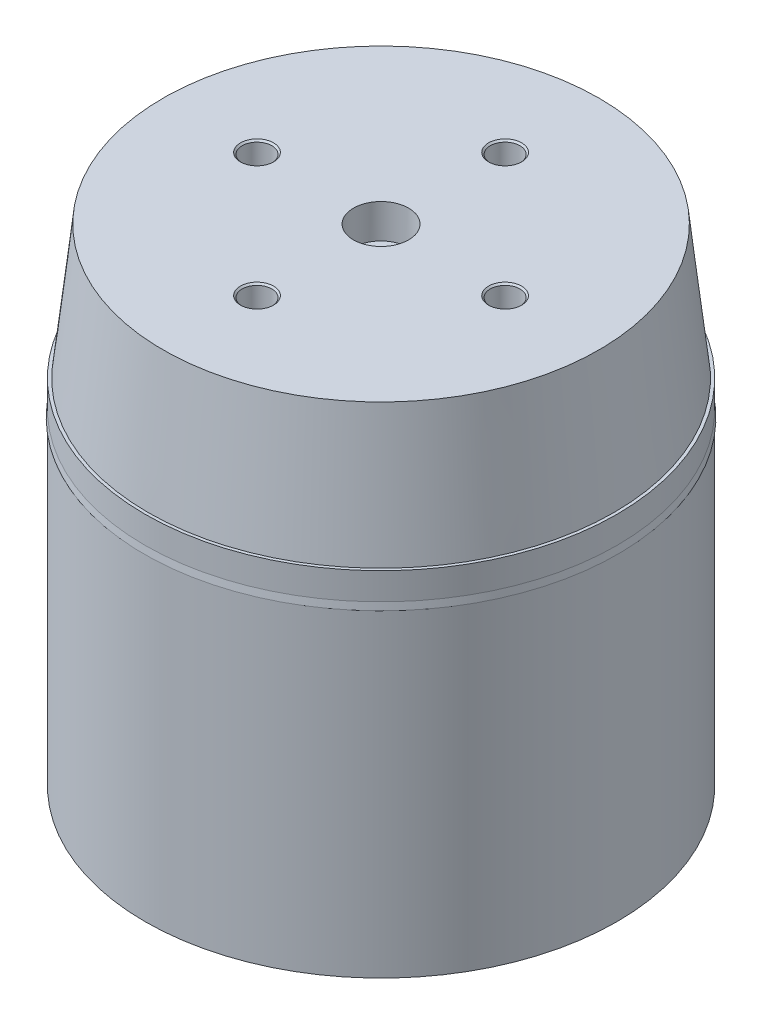
from build123d import *

# Parameters (mm, degrees)
SKETCH_1_R                = 21.4
SKETCH_1_R_2              = 18
EXTRUDE_1_DEPTH           = 32
SKETCH_13_R               = 2.5
CUT_EXTRUDE_1_DEPTH       = 54.544415829
HOLE_WIZARD_1_D           = 2.7
HOLE_WIZARD_1_CSINK_D     = 3
HOLE_WIZARD_1_CSINK_ANGLE = 90


with BuildPart() as part:
    # 草图1 → 凸台-拉伸1 (new body)
    with BuildSketch(Plane(origin=(0, 0, 0), x_dir=(1, 0, 0), z_dir=(0, 1, 0))):
        with Locations(Location((0, 0, 0), (0, 0, 270))):
            Circle(SKETCH_1_R)
        with Locations(Location((0, 0, 0), (0, 0, 270))):
            Circle(SKETCH_1_R_2, mode=Mode.SUBTRACT)
    extrude(amount=EXTRUDE_1_DEPTH)

    # 草图11 → 旋转-薄壁4 (revolve)
    with BuildSketch(Plane(origin=(0, 0, 0), x_dir=(0, 0, -1), z_dir=(1, 0, 0)), mode=Mode.PRIVATE) as revolve_4_sk:
        Polygon((0, 41), (-17, 41), (-18.006981843, 32), (0, 32), (0, 28.9), (-21.473174735, 28.9), (-19.772494289, 44.1), (0, 44.1), align=None)
    revolve(revolve_4_sk.sketch.rotate(Axis((0, 0, 0), (0, 1, 0)), 180), axis=Axis((0, 0, 0), (0, 1, 0)))

    # 草图13 → 切除-拉伸1 (cut, through all)
    with BuildSketch(Plane(origin=(0, 44.1, 0), x_dir=(1, 0, 0), z_dir=(0, 1, 0))):
        with Locations(Location((0, 0, 0), (0, 0, 270))):
            Circle(SKETCH_13_R)
    extrude(amount=-CUT_EXTRUDE_1_DEPTH, mode=Mode.SUBTRACT)

    # 打孔尺寸(%根据)内六角花形半沉头螺钉的类型1 (through all)
    with Locations(Plane(origin=(0, 44.1, -11.25), x_dir=(0, 0, 1), z_dir=(0, 1, 0))):
        with Locations((0, 0), (11.25, 11.25), (22.5, 0), (11.25, -11.25)):
            CounterSinkHole(HOLE_WIZARD_1_D / 2, HOLE_WIZARD_1_CSINK_D / 2, counter_sink_angle=HOLE_WIZARD_1_CSINK_ANGLE)


solid = part.part
